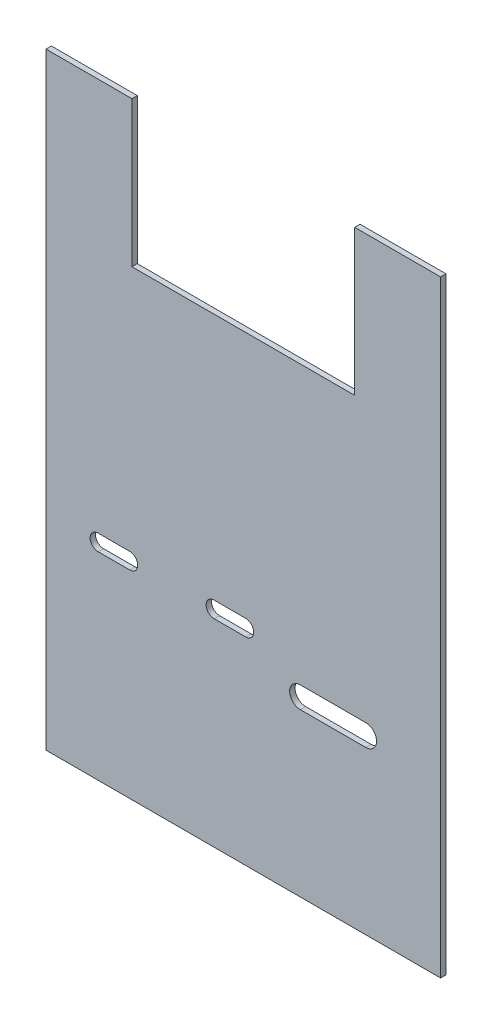
from build123d import *

# Parameters (mm, degrees)
EXTRUDE_1_DEPTH     = 2
CUT_EXTRUDE_1_DEPTH = 2


with BuildPart() as part:
    # 草图1 → 凸台-拉伸1 (new body)
    with BuildSketch(Plane.XY):
        Polygon((-83, 62.119161838), (0, 62.119161838), (0, 116.342711697), (32, 116.342711697), (32, 62.119161838), (32, -109.880838162), (-115, -109.880838162), (-115, 62.119161838), (-115, 116.342711697), (-83, 116.342711697), align=None)
    extrude(amount=EXTRUDE_1_DEPTH)

    # 草图2 → 切除-拉伸1 (cut)
    with BuildSketch(Plane.XY.offset(2)):
        with BuildLine():
            Line((-20.227487309, -41.431118444), (4.13099273, -41.431118444))
            ThreePointArc((4.13099273, -41.431118444), (8.13099273, -45.431118444), (4.13099273, -49.431118444))
            Line((4.13099273, -49.431118444), (-20.227487309, -49.431118444))
            ThreePointArc((-20.227487309, -49.431118444), (-24.227487309, -45.431118444), (-20.227487309, -41.431118444))
        make_face()
        with BuildLine():
            Line((-95.572678874, -30.135740054), (-83.83609572, -30.135740054))
            ThreePointArc((-83.83609572, -30.135740054), (-80.83609572, -33.135740054), (-83.83609572, -36.135740054))
            Line((-83.83609572, -36.135740054), (-95.572678874, -36.135740054))
            ThreePointArc((-95.572678874, -36.135740054), (-98.572678874, -33.135740054), (-95.572678874, -30.135740054))
        make_face()
        with BuildLine():
            Line((-52.358181563, -30.135740054), (-40.621598408, -30.135740054))
            ThreePointArc((-40.621598408, -30.135740054), (-37.621598408, -33.135740054), (-40.621598408, -36.135740054))
            Line((-40.621598408, -36.135740054), (-52.358181563, -36.135740054))
            ThreePointArc((-52.358181563, -36.135740054), (-55.358181563, -33.135740054), (-52.358181563, -30.135740054))
        make_face()
    extrude(amount=-CUT_EXTRUDE_1_DEPTH, mode=Mode.SUBTRACT)


solid = part.part
